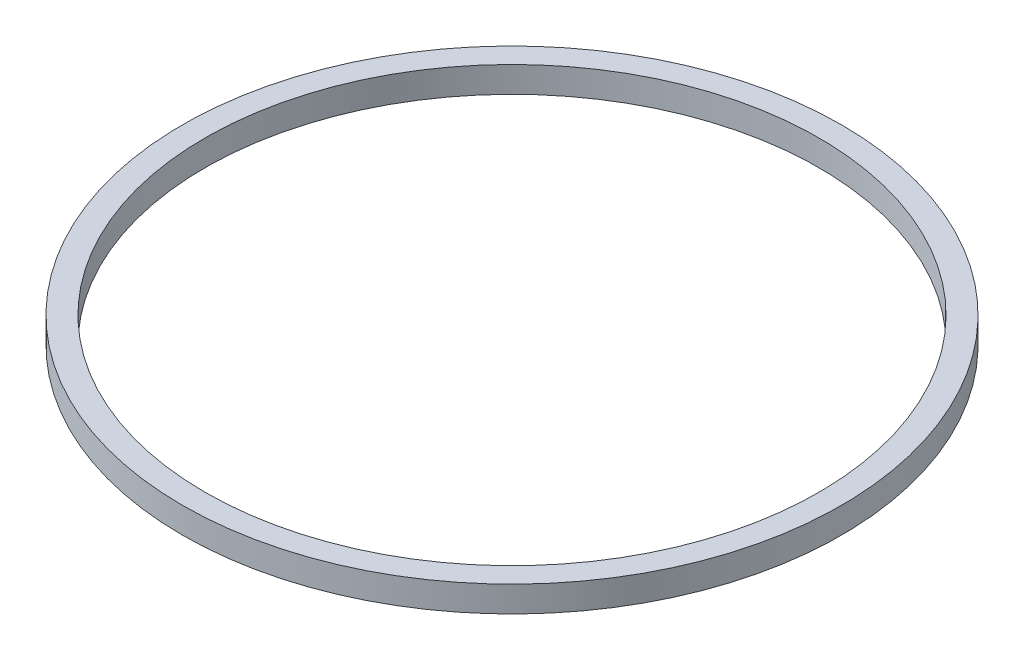
from build123d import *

# Parameters (mm, degrees)
SKETCH_1_R      = 102
SKETCH_1_R_2    = 95
EXTRUDE_1_DEPTH = 8


with BuildPart() as part:
    # 草图1 → 凸台-拉伸1 (new body)
    with BuildSketch(Plane(origin=(0, 0, 0), x_dir=(1, 0, 0), z_dir=(0, 1, 0))):
        with Locations(Location((0, 0, 0), (0, 0, 270))):
            Circle(SKETCH_1_R)
        with Locations(Location((0, 0, 0), (0, 0, 270))):
            Circle(SKETCH_1_R_2, mode=Mode.SUBTRACT)
    extrude(amount=EXTRUDE_1_DEPTH)


solid = part.part
